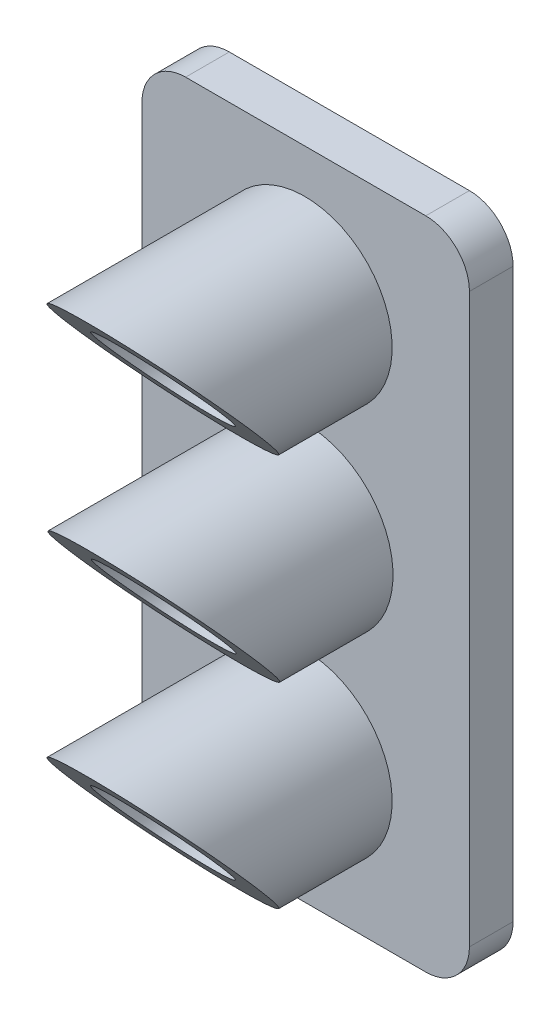
from build123d import *

# Parameters (mm, degrees)
SKETCH1_R             = 4
SKETCH1_R_2           = 2.5
BOSS_EXTRUDE1_DEPTH   = 10
BOSS_EXTRUDE1_2_DEPTH = 10
BOSS_EXTRUDE1_3_DEPTH = 10
SKETCH2_W             = 15
SKETCH2_H             = 30
BOSS_EXTRUDE2_DEPTH   = 2
CUT_EXTRUDE1_START    = -2
SKETCH3_R             = 2.5
CUT_EXTRUDE1_DEPTH    = 2
CUT_EXTRUDE3_DEPTH    = 22
FILLET2_R             = 2


with BuildPart() as part:
    # Sketch1 → Boss-Extrude1 (new body)
    with BuildSketch(Plane.XY):
        with Locations((-0.039690435, 8.999912481)):
            Circle(SKETCH1_R)
        with Locations((-0.039690435, 8.999912481)):
            Circle(SKETCH1_R_2, mode=Mode.SUBTRACT)
    extrude(amount=BOSS_EXTRUDE1_DEPTH)



with BuildPart() as body_2:
    # Sketch1 → Boss-Extrude1 2 (new body)
    with BuildSketch(Plane.XY):
        Circle(SKETCH1_R)
        Circle(SKETCH1_R_2, mode=Mode.SUBTRACT)
    extrude(amount=BOSS_EXTRUDE1_2_DEPTH)


with BuildPart() as body_3:
    # Sketch1 → Boss-Extrude1 3 (new body)
    with BuildSketch(Plane.XY):
        with Locations((-0.039620931, -8.999912787)):
            Circle(SKETCH1_R)
        with Locations((-0.039620931, -8.999912787)):
            Circle(SKETCH1_R_2, mode=Mode.SUBTRACT)
    extrude(amount=BOSS_EXTRUDE1_3_DEPTH)


with BuildPart() as part_1:
    add(part.part)

    add(body_2.part)  # Boss-Extrude2 merges body 2

    add(body_3.part)  # Boss-Extrude2 merges body 3
    # Sketch2 → Boss-Extrude2 (add)
    with BuildSketch(Plane(origin=(0, 0, 0), x_dir=(-1, 0, 0), z_dir=(0, 0, -1))):
        Rectangle(SKETCH2_W, SKETCH2_H)
    extrude(amount=BOSS_EXTRUDE2_DEPTH)

    # Sketch3 → Cut-Extrude1 (cut)
    with BuildSketch(Plane.XY.offset(CUT_EXTRUDE1_START)):
        with Locations((-0.039690435, 8.999912481)):
            Circle(SKETCH3_R)
        Circle(SKETCH3_R)
        with Locations((-0.039620931, -8.999912787)):
            Circle(SKETCH3_R)
    extrude(amount=CUT_EXTRUDE1_DEPTH, mode=Mode.SUBTRACT)

    # Sketch4 → Cut-Extrude3 (cut)
    with BuildSketch(Plane.ZY.offset(7.5)):
        Polygon((10, 4.000087213), (10, -3.999912787), (10, -4.510778231), (3, -4.510778231), (3, -3.999912787), align=None)
        Polygon((10, 13.000087213), (10, 5.000087213), (10, 4.572676738), (3, 4.572676738), (3, 5.000087213), align=None)
        Polygon((10, -4.999912787), (10, -12.999912787), (10, -13.831411627), (3, -13.831411627), (3, -12.999912787), align=None)
    extrude(amount=-CUT_EXTRUDE3_DEPTH, mode=Mode.SUBTRACT)

    # Fillet2
    fillet2_edges = [part_1.edges().sort_by_distance(p)[0] for p in [
        (7.5, -15, -1),
        (-7.5, -15, -1),
        (-7.5, 15, -1),
        (7.5, 15, -1),
    ]]
    fillet(fillet2_edges, radius=FILLET2_R)


solid = part_1.part
